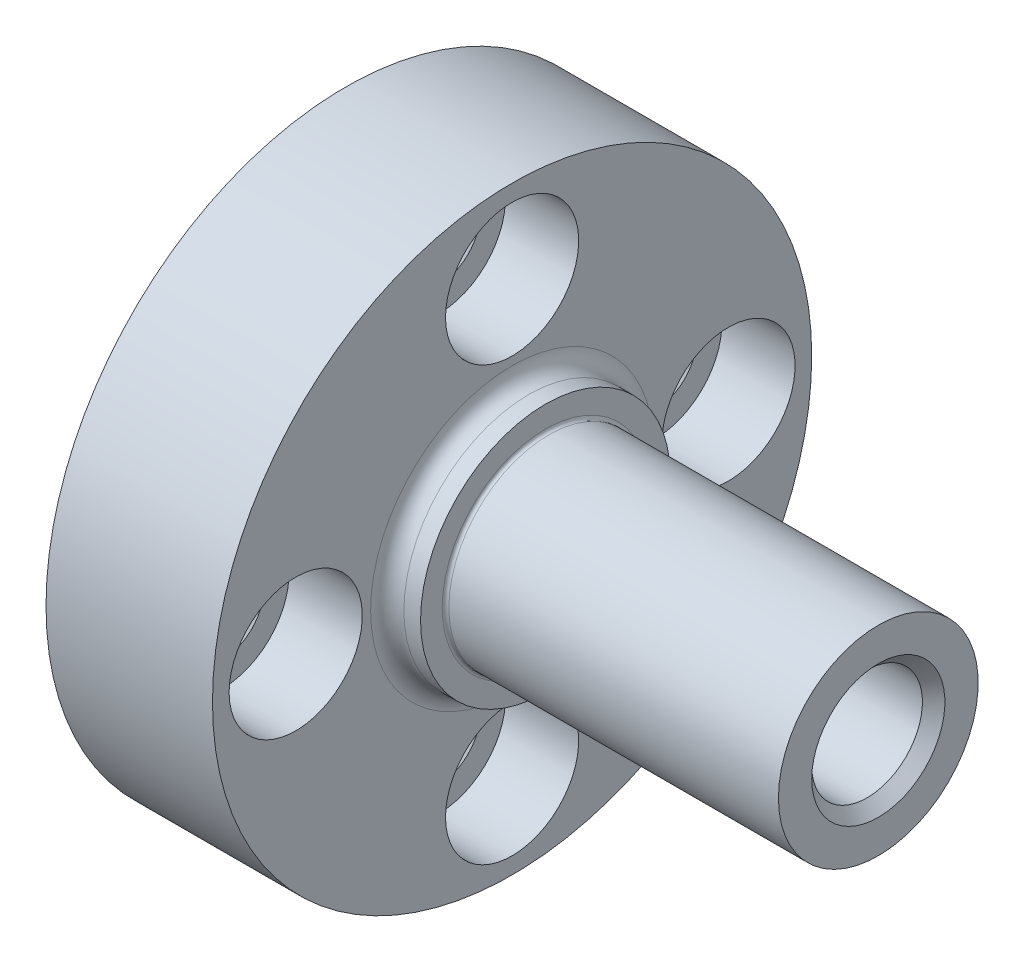
from build123d import *


with BuildPart() as part:
    # Sketch1 → Revolve1 (revolve)
    with BuildSketch(Plane.XY, mode=Mode.PRIVATE) as revolve1_sk:
        with BuildLine():
            Line((0, 0), (0, 18))
            Line((0, 18), (10, 18))
            Line((10, 18), (10, 8.5))
            ThreePointArc((10, 8.5), (10.292893219, 7.792893219), (11, 7.5))
            Line((11, 7.5), (12, 7.5))
            Line((12, 7.5), (12, 6.2))
            ThreePointArc((12, 6.2), (12.058578644, 6.058578644), (12.2, 6))
            Line((12.2, 6), (32, 6))
            Line((32, 6), (32, 0))
            Line((32, 0), (0, 0))
        make_face()
    revolve(revolve1_sk.sketch.rotate(Axis((32, 0, 0), (-1, 0, 0)), 270), axis=Axis((32, 0, 0), (-1, 0, 0)))

    # Sketch2 → Cut-Revolve1 (revolve, cut)
    with BuildSketch(Plane.XY, mode=Mode.PRIVATE) as cut_revolve1_sk:
        Polygon((0, 13), (0, 15.5), (0.433, 15.067), (5.167, 15.067), (5.6, 15.5), (5.6, 17), (10, 17), (10, 13), align=None)
    revolve(cut_revolve1_sk.sketch.rotate(Axis((10, 13, 0), (-1, 0, 0)), 270), axis=Axis((10, 13, 0), (-1, 0, 0)), mode=Mode.SUBTRACT)

    # Sketch3 → Cut-Revolve2 (revolve, cut)
    with BuildSketch(Plane.XY.offset(13), mode=Mode.PRIVATE) as cut_revolve2_sk:
        Polygon((0, 0), (0, 2.5), (0.433, 2.067), (5.167, 2.067), (5.6, 2.5), (5.6, 4), (10, 4), (10, 0), align=None)
    revolve(cut_revolve2_sk.sketch.rotate(Axis((10, 0, 13), (-1, 0, 0)), 270), axis=Axis((10, 0, 13), (-1, 0, 0)), mode=Mode.SUBTRACT)

    # Sketch4 → Cut-Revolve3 (revolve, cut)
    with BuildSketch(Plane.XY, mode=Mode.PRIVATE) as cut_revolve3_sk:
        Polygon((0, -13), (0, -10.5), (0.433, -10.933), (5.167, -10.933), (5.6, -10.5), (5.6, -9), (10, -9), (10, -13), align=None)
    revolve(cut_revolve3_sk.sketch.rotate(Axis((10, -13, 0), (-1, 0, 0)), 270), axis=Axis((10, -13, 0), (-1, 0, 0)), mode=Mode.SUBTRACT)

    # Sketch5 → Cut-Revolve4 (revolve, cut)
    with BuildSketch(Plane.XY.offset(-13), mode=Mode.PRIVATE) as cut_revolve4_sk:
        Polygon((0, 0), (0, 2.5), (0.433, 2.067), (5.167, 2.067), (5.6, 2.5), (5.6, 4), (10, 4), (10, 0), align=None)
    revolve(cut_revolve4_sk.sketch.rotate(Axis((10, 0, -13), (-1, 0, 0)), 270), axis=Axis((10, 0, -13), (-1, 0, 0)), mode=Mode.SUBTRACT)

    # Sketch6 → Cut-Revolve5 (revolve, cut)
    with BuildSketch(Plane.XY, mode=Mode.PRIVATE) as cut_revolve5_sk:
        Polygon((7, 0), (8.91882362, 3.3235), (31.3235, 3.3235), (32, 4), (32, 0), align=None)
    revolve(cut_revolve5_sk.sketch.rotate(Axis((32, 0, 0), (-1, 0, 0)), 270), axis=Axis((32, 0, 0), (-1, 0, 0)), mode=Mode.SUBTRACT)


solid = part.part
